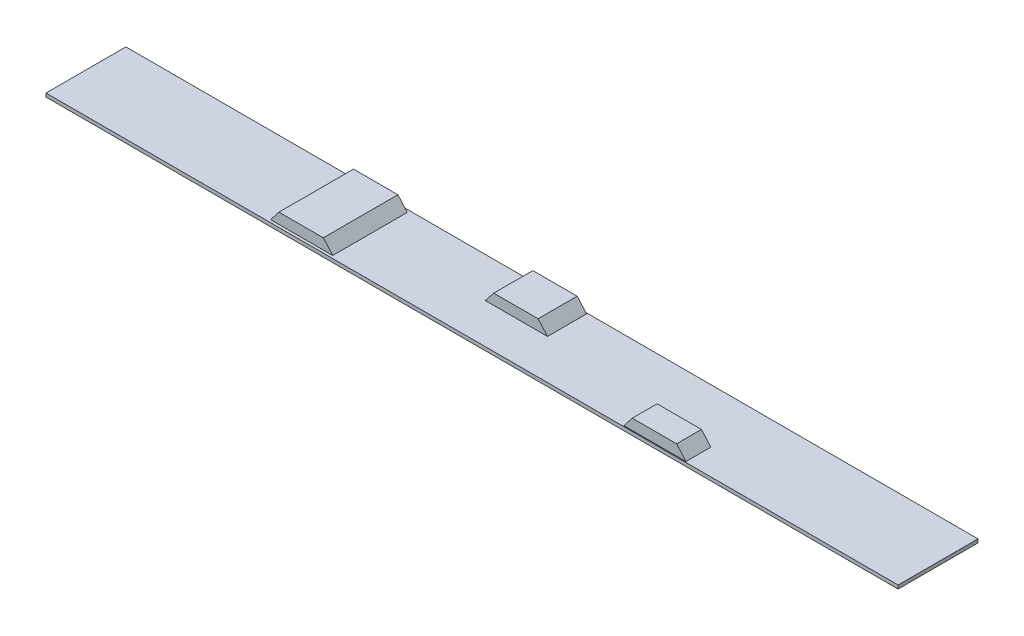
from build123d import *

# Parameters (mm, degrees)
SKETCH1_W           = 2400
SKETCH1_H           = 225
BOSS_EXTRUDE1_DEPTH = 10
BOSS_EXTRUDE2_START = 40
BOSS_EXTRUDE2_DEPTH = 70
BOSS_EXTRUDE5_DEPTH = 110
BOSS_EXTRUDE6_DEPTH = 105


with BuildPart() as part:
    # Sketch1 → Boss-Extrude1 (new body)
    with BuildSketch(Plane(origin=(0, 0, 0), x_dir=(1, 0, 0), z_dir=(0, 1, 0))):
        Rectangle(SKETCH1_W, SKETCH1_H)
    extrude(amount=BOSS_EXTRUDE1_DEPTH)

    # Sketch4 → Boss-Extrude2 (add)
    with BuildSketch(Plane.XY.offset(BOSS_EXTRUDE2_START)):
        Polygon((600, 10), (425, 10), (448.609614239, 40), (573.609614239, 40), align=None)
    extrude(amount=BOSS_EXTRUDE2_DEPTH)

    # Sketch10 → Boss-Extrude5 (add)
    with BuildSketch(Plane.XY):
        Polygon((-75, 10), (100, 10), (73.609614239, 40), (-51.390385761, 40), align=None)
    extrude(amount=-BOSS_EXTRUDE5_DEPTH)

    # Sketch11 → Boss-Extrude6 (add, symmetric)
    with BuildSketch(Plane.XY):
        Polygon((-575, 10), (-400, 10), (-426.390385761, 40), (-551.390385761, 40), align=None)
    extrude(amount=BOSS_EXTRUDE6_DEPTH, both=True)


solid = part.part
